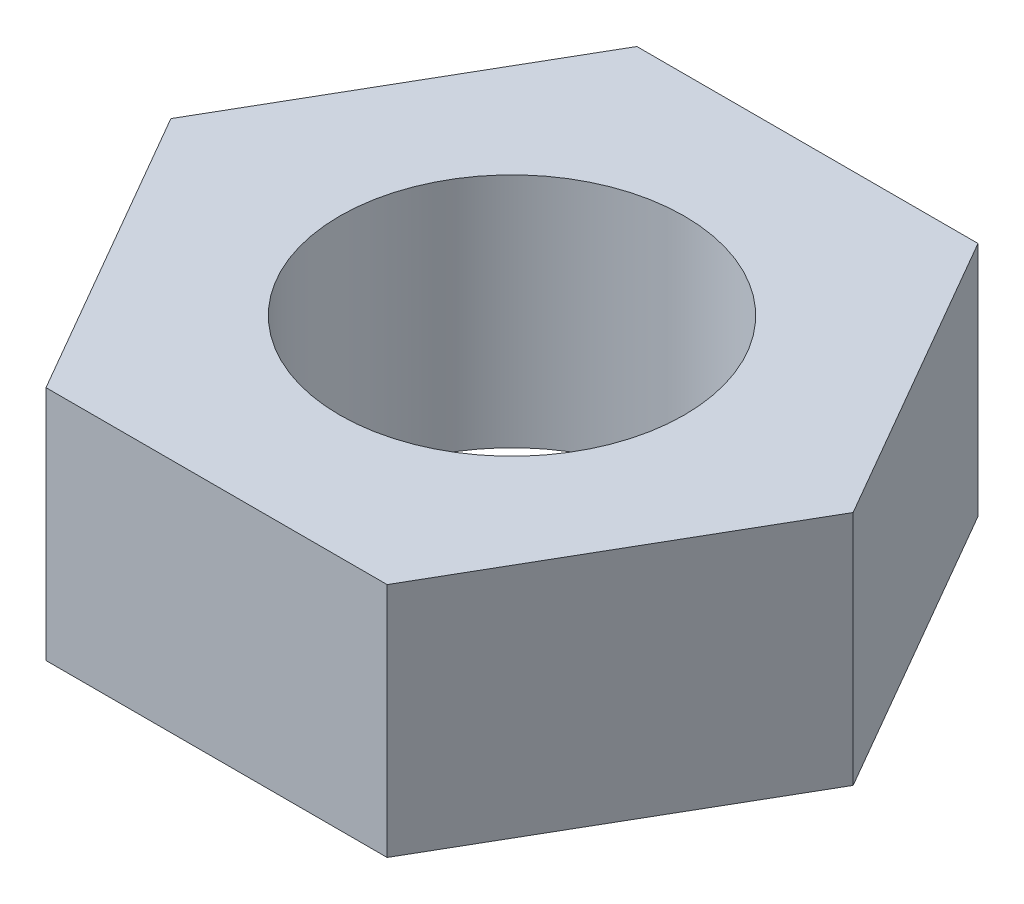
from build123d import *

# Parameters (mm, degrees)
BOSS_EXTRUDE1_DEPTH      = 7.62
F_7_16_20_TAPPED_HOLE1_D = 11.1125


with BuildPart() as part:
    # Sketch1 → Boss-Extrude1 (new body)
    with BuildSketch(Plane(origin=(0, 0, 0), x_dir=(1, 0, 0), z_dir=(0, 1, 0))):
        Polygon((-10.998522628, 0), (-5.499261314, -9.525), (5.499261314, -9.525), (10.998522628, 0), (5.499261314, 9.525), (-5.499261314, 9.525), align=None)
    extrude(amount=BOSS_EXTRUDE1_DEPTH)

    # 7/16-20 Tapped Hole1 (through all)
    with Locations(Plane(origin=(0, 7.62, 0), x_dir=(1, 0, 0), z_dir=(0, 1, 0))):
        with Locations((0, 0)):
            Hole(F_7_16_20_TAPPED_HOLE1_D / 2)


solid = part.part
